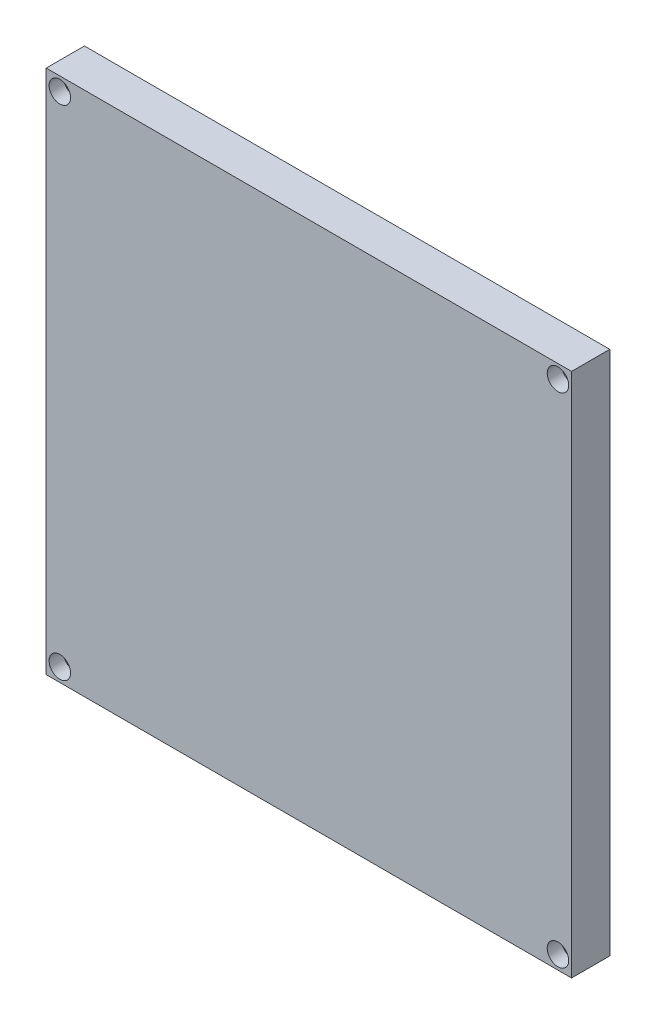
from build123d import *

# Parameters (mm, degrees)
SKETCH2_W           = 110
SKETCH2_H           = 110
BOSS_EXTRUDE1_DEPTH = 8
CUT_EXTRUDE1_REACH  = 80.192
SKETCH4_R           = 1.575
SKETCH5_R           = 2.25
CUT_EXTRUDE2_DEPTH  = 3


with BuildPart() as part:
    # Sketch2 → Boss-Extrude1 (new body)
    with BuildSketch(Plane.XY):
        Rectangle(SKETCH2_W, SKETCH2_H)
    extrude(amount=BOSS_EXTRUDE1_DEPTH)

    # Sketch4 → Cut-Extrude1 (cut, up to next)
    with BuildSketch(Plane.XY.offset(8), mode=Mode.PRIVATE) as cut_extrude1_sk1:
        with Locations((-52.149125113, 52.149125113)):
            Circle(SKETCH4_R)
    cut_extrude1_tool1 = extrude(cut_extrude1_sk1.sketch, amount=-CUT_EXTRUDE1_REACH, mode=Mode.PRIVATE) & part.part
    # Sketch4 → Cut-Extrude1 (cut, up to next)
    with BuildSketch(Plane.XY.offset(8), mode=Mode.PRIVATE) as cut_extrude1_sk2:
        with Locations((-52.149125113, -52.149125113)):
            Circle(SKETCH4_R)
    cut_extrude1_tool2 = extrude(cut_extrude1_sk2.sketch, amount=-CUT_EXTRUDE1_REACH, mode=Mode.PRIVATE) & part.part
    # Sketch4 → Cut-Extrude1 (cut, up to next)
    with BuildSketch(Plane.XY.offset(8), mode=Mode.PRIVATE) as cut_extrude1_sk3:
        with Locations((52.149125113, -52.149125113)):
            Circle(SKETCH4_R)
    cut_extrude1_tool3 = extrude(cut_extrude1_sk3.sketch, amount=-CUT_EXTRUDE1_REACH, mode=Mode.PRIVATE) & part.part
    # Sketch4 → Cut-Extrude1 (cut, up to next)
    with BuildSketch(Plane.XY.offset(8), mode=Mode.PRIVATE) as cut_extrude1_sk4:
        with Locations((52.149125113, 52.149125113)):
            Circle(SKETCH4_R)
    cut_extrude1_tool4 = extrude(cut_extrude1_sk4.sketch, amount=-CUT_EXTRUDE1_REACH, mode=Mode.PRIVATE) & part.part
    add(cut_extrude1_tool1.solids().sort_by_distance((-52.149125, 52.149125, 8))[0], mode=Mode.SUBTRACT)
    add(cut_extrude1_tool2.solids().sort_by_distance((-52.149125, -52.149125, 8))[0], mode=Mode.SUBTRACT)
    add(cut_extrude1_tool3.solids().sort_by_distance((52.149125, -52.149125, 8))[0], mode=Mode.SUBTRACT)
    add(cut_extrude1_tool4.solids().sort_by_distance((52.149125, 52.149125, 8))[0], mode=Mode.SUBTRACT)

    # Sketch5 → Cut-Extrude2 (cut)
    with BuildSketch(Plane.XY.offset(8)):
        with Locations((-52.149125113, 52.149125113)):
            Circle(SKETCH5_R)
        with Locations(Location((-52.149125113, -52.149125113, 0), (0, 0, 180))):
            Circle(SKETCH5_R)
        with Locations((52.149125113, -52.149125113)):
            Circle(SKETCH5_R)
        with Locations(Location((52.149125113, 52.149125113, 0), (0, 0, 180))):
            Circle(SKETCH5_R)
    extrude(amount=-CUT_EXTRUDE2_DEPTH, mode=Mode.SUBTRACT)


solid = part.part
